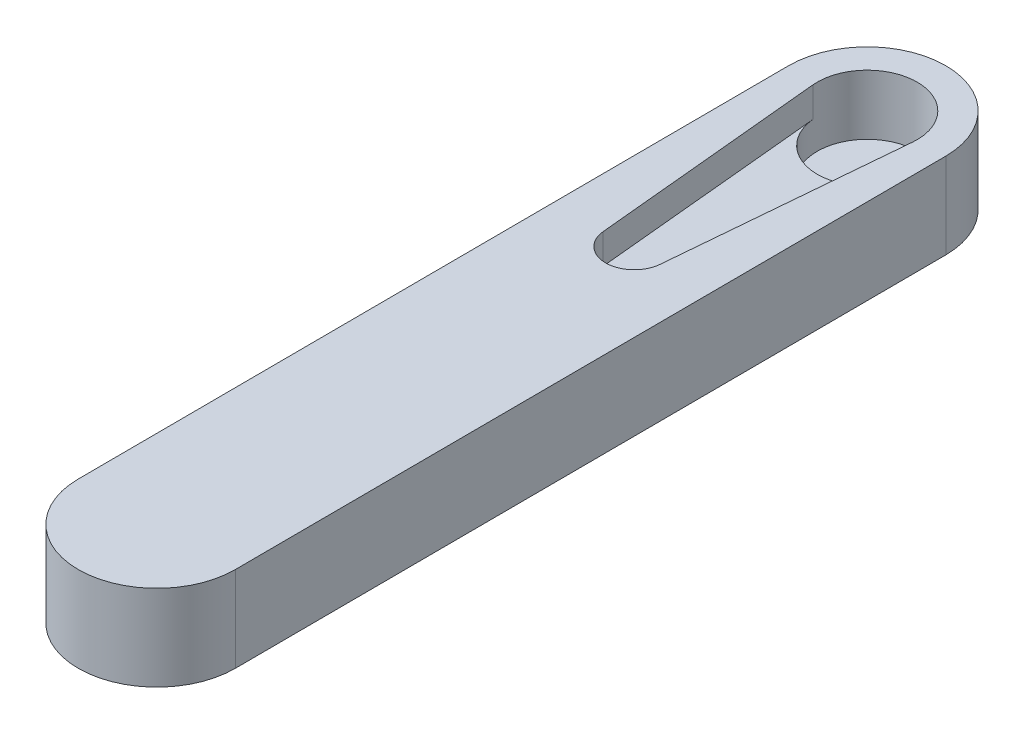
from build123d import *

# Parameters (mm, degrees)
EXTRUDE_1_DEPTH     = 6
CUT_EXTRUDE_1_DEPTH = 2.1
SKETCH_4_R          = 3.5
CUT_EXTRUDE_2_DEPTH = 2.1


with BuildPart() as part:
    # Эскиз2 → Бобышка-Вытянуть1 (new body)
    with BuildSketch(Plane(origin=(0, 0, 0), x_dir=(1, 0, 0), z_dir=(0, 1, 0))):
        with BuildLine():
            Line((-5.696343687, 30.010357476), (-5.499915116, -19.989642524))
            ThreePointArc((-5.499915116, -19.989642524), (0.021649418, -25.467993105), (5.5, -19.946428571))
            Line((5.5, -19.946428571), (5.303571429, 30.053571429))
            ThreePointArc((5.303571429, 30.053571429), (-0.217993105, 35.53192201), (-5.696343687, 30.010357476))
        make_face()
    extrude(amount=EXTRUDE_1_DEPTH)

    # Эскиз3 → Вырез-Вытянуть1 (cut)
    with BuildSketch(Plane(origin=(0, 6, 0), x_dir=(1, 0, 0), z_dir=(0, 1, 0))):
        with BuildLine():
            Line((-3.680431468, 29.698156009), (-2.122840442, 13.441174328))
            ThreePointArc((-2.122840442, 13.441174328), (-0.124100309, 11.631937444), (1.860362916, 13.456822627))
            Line((1.860362916, 13.456822627), (3.290174408, 29.725540532))
            ThreePointArc((3.290174408, 29.725540532), (-0.210136023, 33.531937444), (-3.680431468, 29.698156009))
        make_face()
    extrude(amount=-CUT_EXTRUDE_1_DEPTH, mode=Mode.SUBTRACT)

    # Эскиз4 → Вырез-Вытянуть2 (cut)
    with BuildSketch(Plane(origin=(0, 3.9, 0), x_dir=(1, 0, 0), z_dir=(0, 1, 0))):
        with Locations(Location((-0.196386129, 30.031964452, 0), (0, 0, 270))):
            Circle(SKETCH_4_R)
    extrude(amount=-CUT_EXTRUDE_2_DEPTH, mode=Mode.SUBTRACT)


solid = part.part
